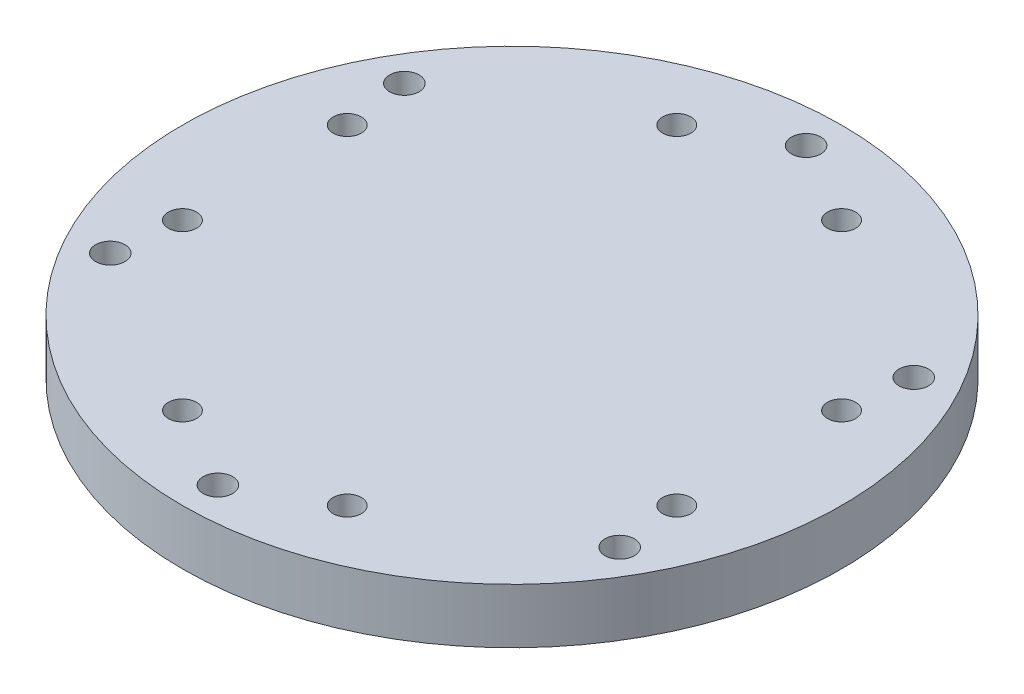
from build123d import *

# Parameters (mm, degrees)
SKETCH1_R                = 76.2
BOSS_EXTRUDE1_DEPTH      = 12.7
M8X1_25_TAPPED_HOLE1_D   = 6.8
CIRPATTERN3_COUNT        = 6
F_5_16_18_TAPPED_HOLE1_D = 6.5278
CIRPATTERN2_COUNT        = 4


with BuildPart() as part:
    # Sketch1 → Boss-Extrude1 (new body)
    with BuildSketch(Plane(origin=(0, 0, 0), x_dir=(1, 0, 0), z_dir=(0, 1, 0))):
        with Locations(Location((0, 0, 0), (0, 0, 270))):
            Circle(SKETCH1_R)
    extrude(amount=BOSS_EXTRUDE1_DEPTH)

    # M8x1.25 Tapped Hole1 (through all)
    with Locations(Plane(origin=(0, 12.7, 0), x_dir=(1, 0, 0), z_dir=(0, 1, 0))):
        with Locations((0, 68)):
            m8x1_25_tapped_hole1 = Hole(M8X1_25_TAPPED_HOLE1_D / 2)

    # CirPattern3: M8x1.25 Tapped Hole1 ×6 about axis
    cirpattern3_axis = Axis((0, 0, 0), (0, 1, 0))
    for i in range(1, CIRPATTERN3_COUNT):
        add(m8x1_25_tapped_hole1.rotate(cirpattern3_axis, i * 360 / CIRPATTERN3_COUNT), mode=Mode.SUBTRACT)

    # 5/16-18 Tapped Hole1 (through all)
    with Locations(Plane(origin=(0, 0, 0), x_dir=(-1, 0, 0), z_dir=(0, -1, 0))):
        with Locations((-19.049999999, 57.15), (19.049999999, 57.15)):
            f_5_16_18_tapped_hole1 = Hole(F_5_16_18_TAPPED_HOLE1_D / 2)

    # CirPattern2: 5/16-18 Tapped Hole1 ×4 about axis
    cirpattern2_axis = Axis((0, 0, 0), (0, 1, 0))
    for i in range(1, CIRPATTERN2_COUNT):
        add(f_5_16_18_tapped_hole1.rotate(cirpattern2_axis, i * 360 / CIRPATTERN2_COUNT), mode=Mode.SUBTRACT)


solid = part.part
